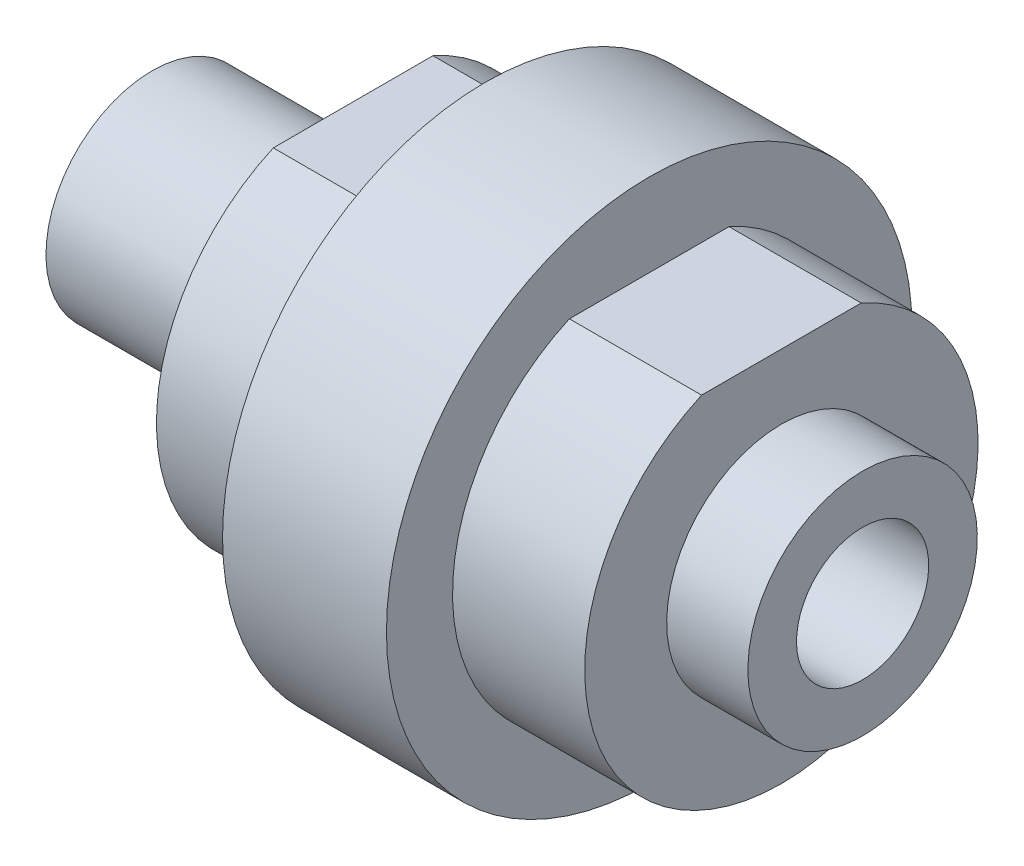
from build123d import *

# Parameters (mm, degrees)
CUT_EXTRUDE1_DEPTH      = 39.514968698
CUT_EXTRUDE1_DEPTH_BACK = 39.514968698
SKETCH2_W               = 6.35
SKETCH2_H               = 0.8128


with BuildPart() as part:
    # Sketch1 → Revolve1 (revolve)
    with BuildSketch(Plane.XY):
        Polygon((0, 5.1054), (0, 3.175), (34.12744, 3.175), (34.12744, 5.5118), (30.226, 5.5118), (30.226, 9.4488), (23.876, 9.4488), (23.876, 12.6238), (16.002, 12.6238), (16.002, 9.4488), (9.652, 9.4488), (9.652, 5.1054), align=None)
    revolve(axis=Axis((34.12744, 0, 0), (-1, 0, 0)))

    # Sketch2 → Cut-Extrude1 (cut, two sides: drawn at the far end of the back side and taken through both)
    with BuildSketch(Plane.XY.offset(-CUT_EXTRUDE1_DEPTH_BACK)):
        with Locations((12.827, 9.0424)):
            Rectangle(SKETCH2_W, SKETCH2_H)
        with Locations((27.051, 9.0424)):
            Rectangle(SKETCH2_W, SKETCH2_H)
    extrude(amount=CUT_EXTRUDE1_DEPTH + CUT_EXTRUDE1_DEPTH_BACK, mode=Mode.SUBTRACT)


solid = part.part
